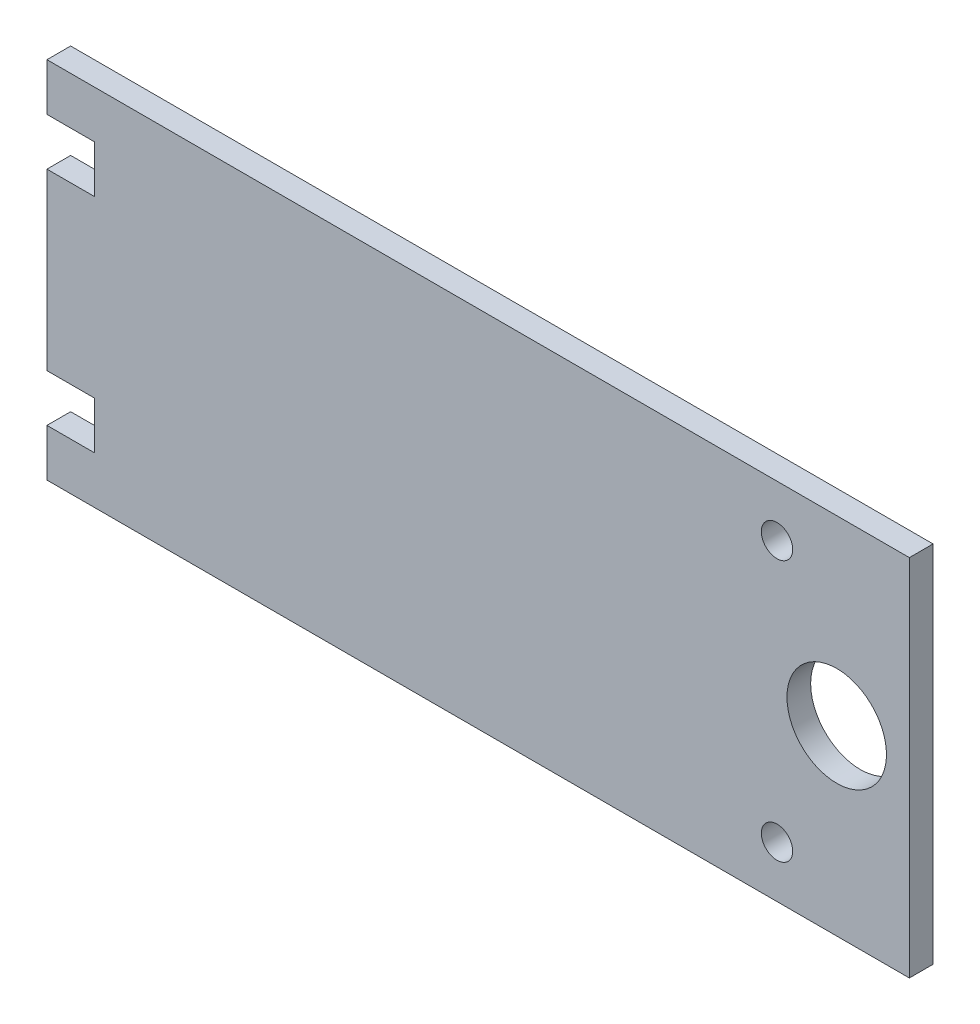
from build123d import *

# Parameters (mm, degrees)
SKETCH1_W           = 115.57
SKETCH1_H           = 48.789667988
BOSS_EXTRUDE1_DEPTH = 3.175
SKETCH2_R           = 2.10185
SKETCH2_R_2         = 6.6675
CUT_EXTRUDE1_DEPTH  = 63.80362072
SKETCH3_W           = 6.35
SKETCH3_H           = 6.35
CUT_EXTRUDE2_DEPTH  = 63.80362072


with BuildPart() as part:
    # Sketch1 → Boss-Extrude1 (new body)
    with BuildSketch(Plane.XY):
        Rectangle(SKETCH1_W, SKETCH1_H)
    extrude(amount=BOSS_EXTRUDE1_DEPTH)

    # Sketch2 → Cut-Extrude1 (cut, through all)
    with BuildSketch(Plane(origin=(0, 0, 0), x_dir=(-1, 0, 0), z_dir=(0, 0, -1))):
        with Locations((-40.04893274, 17.5)):
            Circle(SKETCH2_R)
        with Locations((-40.04893274, -17.5)):
            Circle(SKETCH2_R)
        with Locations((-48.04893274, 0)):
            Circle(SKETCH2_R_2)
    extrude(amount=-CUT_EXTRUDE1_DEPTH, mode=Mode.SUBTRACT)

    # Sketch3 → Cut-Extrude2 (cut, through all)
    with BuildSketch(Plane.XY.offset(3.175)):
        with Locations((-54.61, 14.869833994)):
            Rectangle(SKETCH3_W, SKETCH3_H)
        with Locations((-54.61, -14.869833994)):
            Rectangle(SKETCH3_W, SKETCH3_H)
    extrude(amount=-CUT_EXTRUDE2_DEPTH, mode=Mode.SUBTRACT)


solid = part.part
